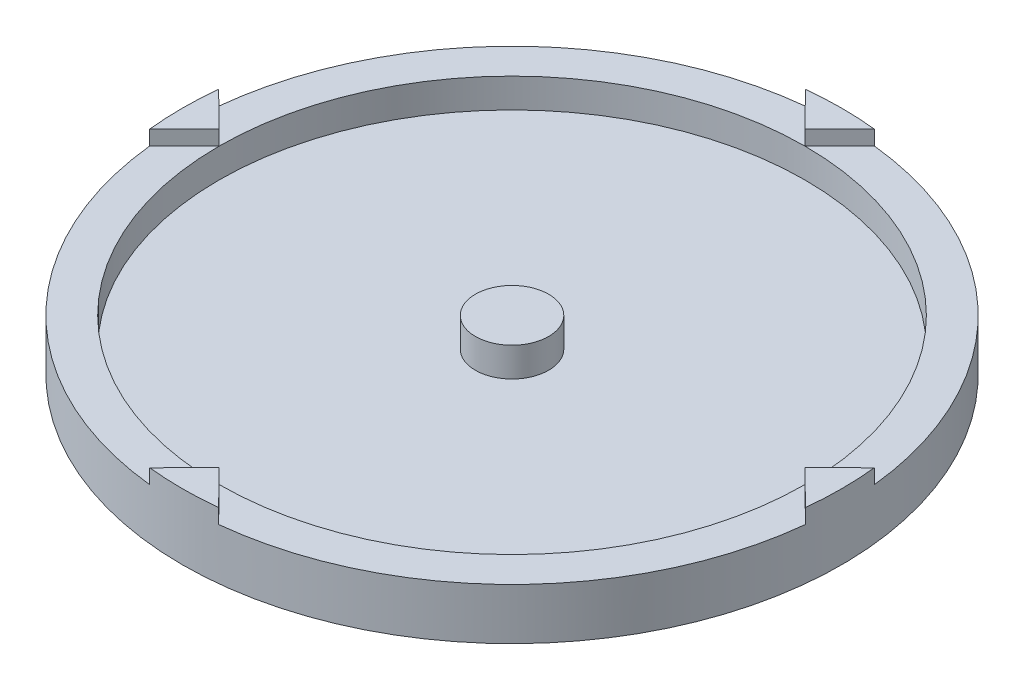
from build123d import *
from build123d.topology import SkipClean

# Parameters (mm, degrees)
SKETCH1_R           = 45
BOSS_EXTRUDE1_DEPTH = 7
SKETCH2_R           = 40
CUT_EXTRUDE1_DEPTH  = 4
SKETCH3_R           = 5
BOSS_EXTRUDE2_DEPTH = 4
BOSS_EXTRUDE3_DEPTH = 2
CIRPATTERN1_COUNT   = 4
SKETCH5_R           = 4.9
BOSS_EXTRUDE4_DEPTH = 8


with BuildPart() as part:
    # Sketch1 → Boss-Extrude1 (new body)
    with BuildSketch(Plane(origin=(0, 0, 0), x_dir=(1, 0, 0), z_dir=(0, 1, 0))):
        with Locations(Location((0, 0, 0), (0, 0, 270))):
            Circle(SKETCH1_R)
    extrude(amount=BOSS_EXTRUDE1_DEPTH)

    # Sketch2 → Cut-Extrude1 (cut)
    with BuildSketch(Plane(origin=(0, 7, 0), x_dir=(1, 0, 0), z_dir=(0, 1, 0))):
        with Locations(Location((0, 0, 0), (0, 0, 270))):
            Circle(SKETCH2_R)
    extrude(amount=-CUT_EXTRUDE1_DEPTH, mode=Mode.SUBTRACT)

    # Sketch3 → Boss-Extrude2 (add)
    with BuildSketch(Plane(origin=(0, 3, 0), x_dir=(1, 0, 0), z_dir=(0, 1, 0))):
        with Locations(Location((0, 0, 0), (0, 0, 270))):
            Circle(SKETCH3_R)
    extrude(amount=BOSS_EXTRUDE2_DEPTH)

    # Sketch4 → Boss-Extrude3 (add)
    with SkipClean():  # the faces are left unmerged after this step: merging them gives an invalid solid
        with BuildSketch(Plane(origin=(0, 7, 0), x_dir=(1, 0, 0), z_dir=(0, 1, 0))):
            with BuildLine():
                Line((0, 40), (-4.703780847, 44.753485292))
                ThreePointArc((-4.703780847, 44.753485292), (0, 45), (4.703780847, 44.753485292))
                Line((4.703780847, 44.753485292), (0, 40))
            make_face()
        boss_extrude3 = extrude(amount=BOSS_EXTRUDE3_DEPTH)

    # CirPattern1: Boss-Extrude3 ×4 about axis
    with SkipClean():  # the faces are left unmerged after this step: merging them gives an invalid solid
        cirpattern1_axis = Axis((0, 0, 0), (0, 1, 0))
        for i in range(1, CIRPATTERN1_COUNT):
            add(boss_extrude3.rotate(cirpattern1_axis, i * 360 / CIRPATTERN1_COUNT))

    # Sketch5 → Boss-Extrude4 (add)
    with SkipClean():  # the faces are left unmerged after this step: merging them gives an invalid solid
        with BuildSketch(Plane(origin=(0, 0, 0), x_dir=(-1, 0, 0), z_dir=(0, -1, 0))):
            with Locations(Location((30, 0, 0), (0, 0, 270))):
                Circle(SKETCH5_R)
        boss_extrude4 = extrude(amount=BOSS_EXTRUDE4_DEPTH)

    # Mirror1: Boss-Extrude4 across plane
    with SkipClean():  # the faces are left unmerged after this step: merging them gives an invalid solid
        add(boss_extrude4.mirror(Plane(origin=(0, 0, 0), x_dir=(0, 0, 1), z_dir=(1, 0, 0))))


solid = part.part
